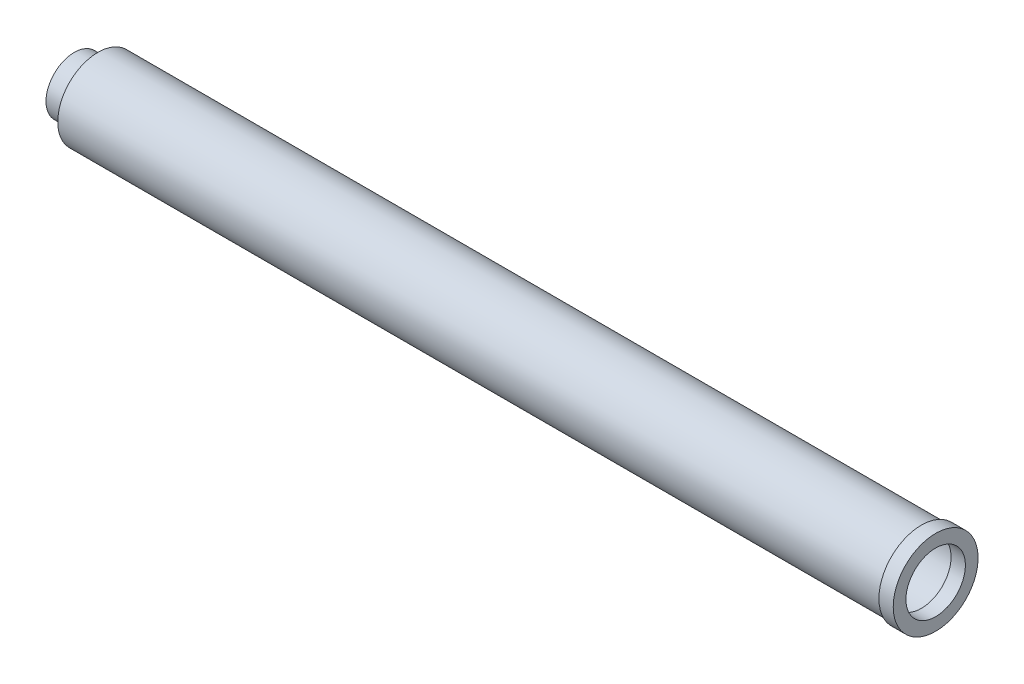
from build123d import *

# Parameters (mm, degrees)
SKETCH1_W = 550
SKETCH1_H = 1.6
SKETCH2_W = 9.6
SKETCH2_H = 8.524943062


with BuildPart() as part:
    # Sketch1 → Revolve1 (revolve)
    with BuildSketch(Plane.XY, mode=Mode.PRIVATE) as revolve1_sk:
        with Locations((82.249266675, 26.2)):
            Rectangle(SKETCH1_W, SKETCH1_H)
    revolve(revolve1_sk.sketch.rotate(Axis((-404.790100073, 0, 0), (1, 0, 0)), 90), axis=Axis((-404.790100073, 0, 0), (1, 0, 0)))

    # Sketch2 → Revolve2 (revolve)
    with BuildSketch(Plane.XY, mode=Mode.PRIVATE) as revolve2_sk:
        with Locations((362.049266675, 24.237528469)):
            Rectangle(SKETCH2_W, SKETCH2_H)
        Polygon((-176.750733325, 27), (-176.750733325, 14.5), (-202.260733325, 14.5), (-202.260733325, 0), (-204.250733325, 0), (-204.250733325, 11), (-211.750733325, 11), (-211.750733325, 19), (-195.850733325, 19), (-195.850733325, 27), align=None)
    revolve(revolve2_sk.sketch.rotate(Axis((-209.882463346, 0, 0), (1, 0, 0)), 90), axis=Axis((-209.882463346, 0, 0), (1, 0, 0)))


solid = part.part
